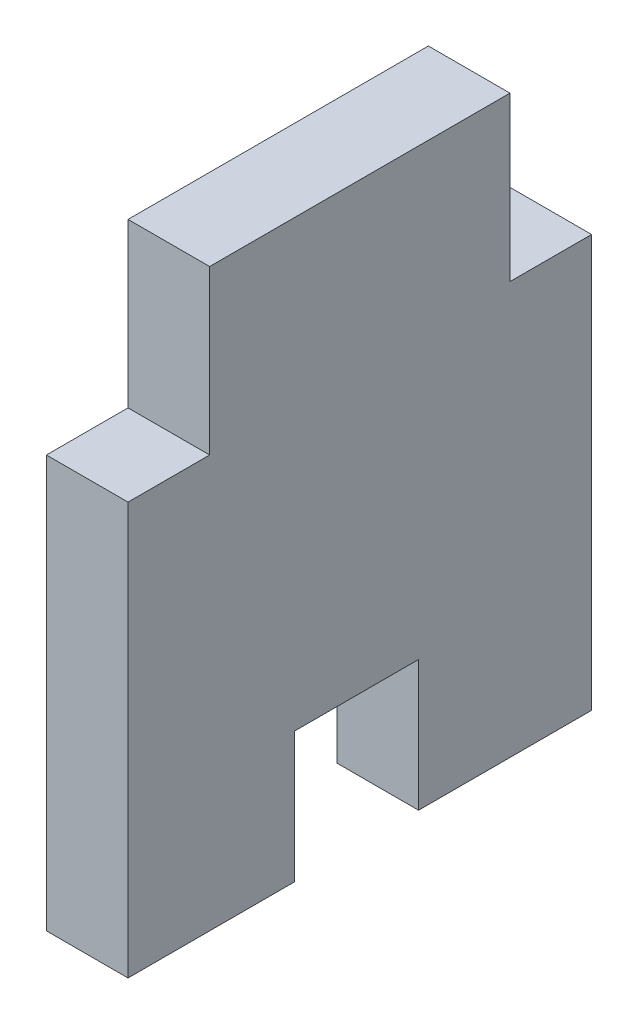
from build123d import *

# Parameters (mm, degrees)
BOSS_EXTRUDE1_DEPTH = 6.35


with BuildPart() as part:
    # Sketch1 → Boss-Extrude1 (new body)
    with BuildSketch(Plane(origin=(0, 0, 0), x_dir=(0, 0, -1), z_dir=(1, 0, 0))):
        Polygon((11.684, 12.7), (-11.684, 12.7), (-11.684, 0), (-18.034, 0), (-18.034, -32.0675), (-5.08, -32.0675), (-5.08, -21.9075), (4.572, -21.9075), (4.572, -32.0675), (18.034, -32.0675), (18.034, 0), (11.684, 0), align=None)
    extrude(amount=BOSS_EXTRUDE1_DEPTH)


solid = part.part
